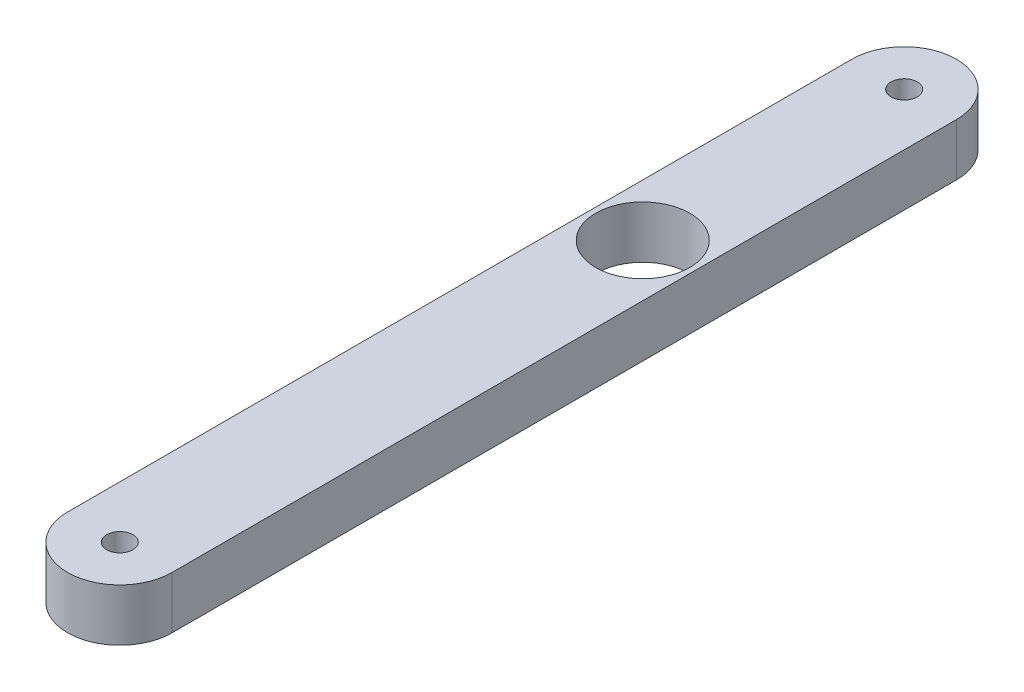
from build123d import *

# Parameters (mm, degrees)
SKETCH1_R            = 2.5
BOSS_EXTRUDE1_DEPTH  = 10
SKETCH2_R            = 9
MOTORMOUNTBORE_DEPTH = 87.168439698


with BuildPart() as part:
    # Sketch1 → Boss-Extrude1 (new body)
    with BuildSketch(Plane(origin=(0, 0, 0), x_dir=(1, 0, 0), z_dir=(0, 1, 0))):
        with BuildLine():
            Line((-10, -75), (-10, 75))
            ThreePointArc((-10, 75), (0, 85), (10, 75))
            Line((10, 75), (10, -75))
            ThreePointArc((10, -75), (0, -85), (-10, -75))
        make_face()
        with Locations(Location((0, 75, 0), (0, 0, 270))):
            Circle(SKETCH1_R, mode=Mode.SUBTRACT)
        with Locations(Location((0, -75, 0), (0, 0, 270))):
            Circle(SKETCH1_R, mode=Mode.SUBTRACT)
    extrude(amount=BOSS_EXTRUDE1_DEPTH)

    # Sketch2 → MotorMountBore (cut, through all)
    with BuildSketch(Plane(origin=(0, 10, 0), x_dir=(1, 0, 0), z_dir=(0, 1, 0))):
        with Locations(Location((0, 25, 0), (0, 0, 270))):
            Circle(SKETCH2_R)
    extrude(amount=-MOTORMOUNTBORE_DEPTH, mode=Mode.SUBTRACT)


solid = part.part
